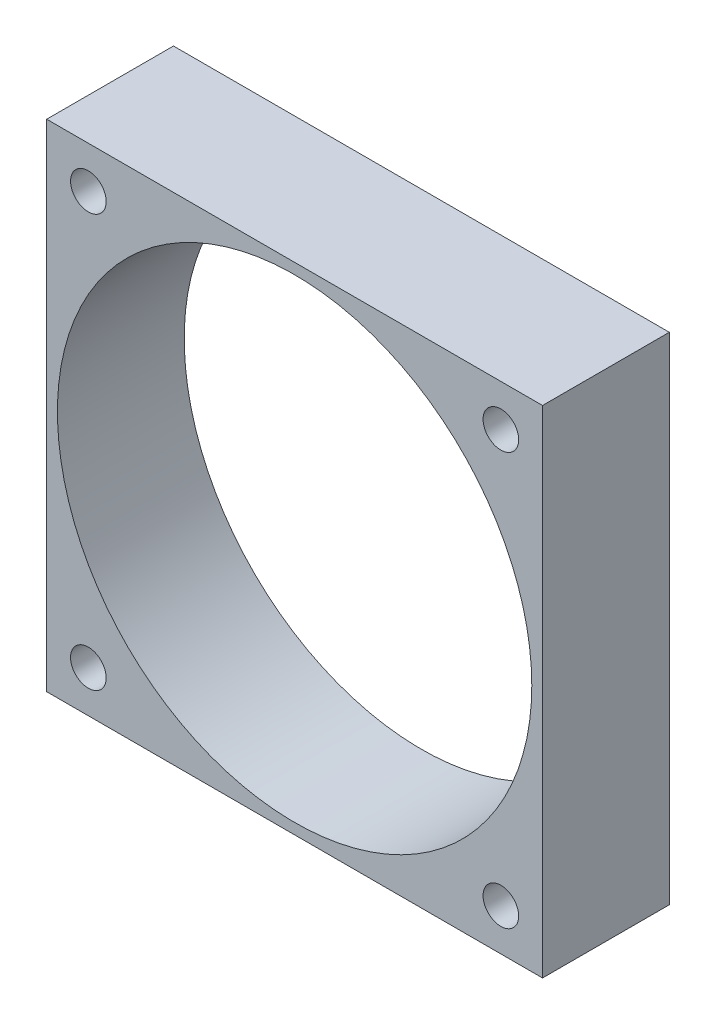
from build123d import *

# Parameters (mm, degrees)
SKETCH1_W           = 60.1
SKETCH1_H           = 60.1
SKETCH1_R           = 2.159
SKETCH1_R_2         = 28.75
BOSS_EXTRUDE1_DEPTH = 15.367


with BuildPart() as part:
    # Sketch1 → Boss-Extrude1 (new body)
    with BuildSketch(Plane.XY):
        Rectangle(SKETCH1_W, SKETCH1_H)
        with Locations((25, 25)):
            Circle(SKETCH1_R, mode=Mode.SUBTRACT)
        with Locations((25, -25)):
            Circle(SKETCH1_R, mode=Mode.SUBTRACT)
        with Locations((-25, -25)):
            Circle(SKETCH1_R, mode=Mode.SUBTRACT)
        with Locations((-25, 25)):
            Circle(SKETCH1_R, mode=Mode.SUBTRACT)
        Circle(SKETCH1_R_2, mode=Mode.SUBTRACT)
    extrude(amount=BOSS_EXTRUDE1_DEPTH)


solid = part.part
